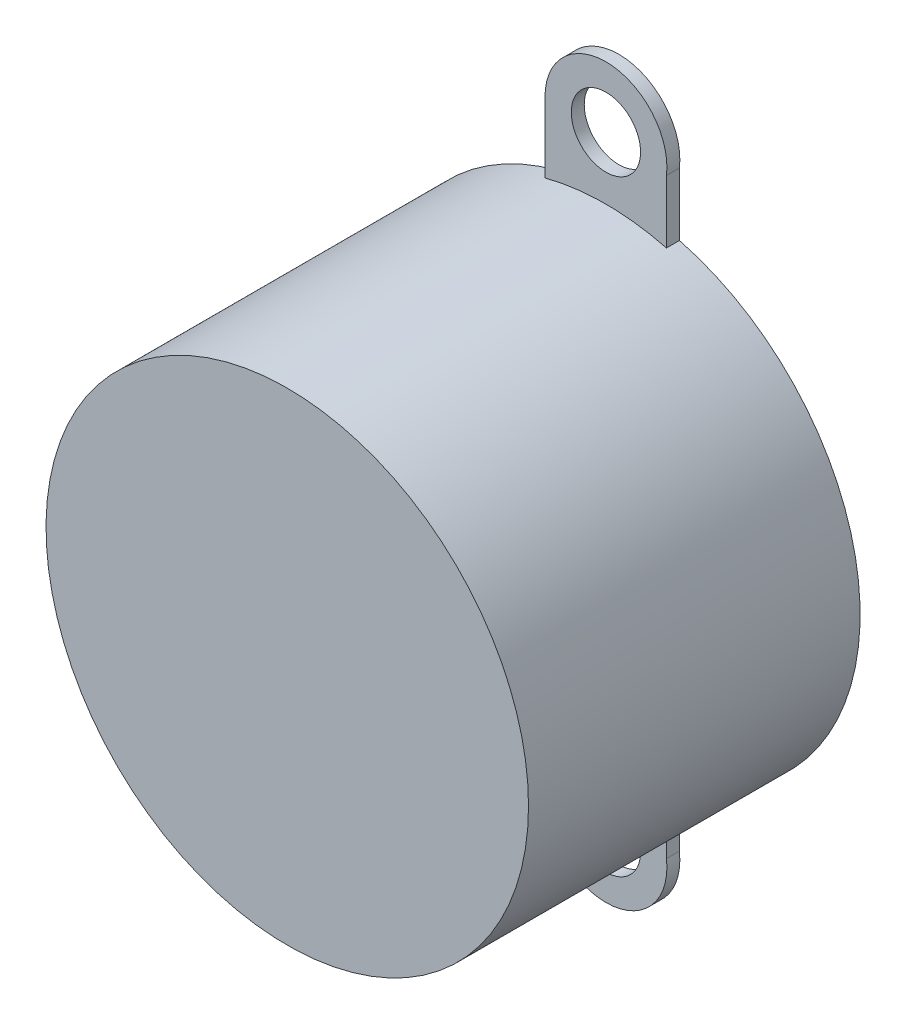
from build123d import *

# Parameters (mm, degrees)
SKETCH1_R           = 13.97
BOSS_EXTRUDE1_DEPTH = 19.2024
SKETCH1_3_R         = 2.0066
BOSS_EXTRUDE2_DEPTH = 0.7493
SKETCH2_R           = 4.5212
BOSS_EXTRUDE3_DEPTH = 1.5748
SKETCH3_R           = 2.4511
BOSS_EXTRUDE4_DEPTH = 8.3312


with BuildPart() as part:
    # Sketch1 → Boss-Extrude1 (new body)
    with BuildSketch(Plane.XY):
        Circle(SKETCH1_R)
    extrude(amount=BOSS_EXTRUDE1_DEPTH)

    # Sketch1<3> → Boss-Extrude2 (add)
    # profile 1 of 2: a face of its own
    with BuildSketch(Plane.XY):
        with BuildLine():
            Line((3.5052, 13.52310885), (3.5052, 17.154059749))
            ThreePointArc((3.5052, 17.154059749), (0.211751316, 21.101044279), (-3.5306, 17.5768))
            Line((-3.5306, 17.5768), (-3.5306, 13.516499682))
            ThreePointArc((-3.5306, 13.516499682), (-0.013122891, 13.969993836), (3.5052, 13.52310885))
        make_face()
        with Locations((0, 17.5768)):
            Circle(SKETCH1_3_R, mode=Mode.SUBTRACT)
    # profile 2 of 2: a face of its own
    with BuildSketch(Plane.XY):
        with BuildLine():
            ThreePointArc((3.5052, -13.52310885), (-0.013122891, -13.969993836), (-3.5306, -13.516499682))
            Line((-3.5306, -13.516499682), (-3.5306, -17.526))
            ThreePointArc((-3.5306, -17.526), (0.211751316, -21.050244279), (3.5052, -17.103259749))
            Line((3.5052, -17.103259749), (3.5052, -13.52310885))
        make_face()
        with Locations((0, -17.526)):
            Circle(SKETCH1_3_R, mode=Mode.SUBTRACT)
    extrude(amount=BOSS_EXTRUDE2_DEPTH)

    # Sketch2 → Boss-Extrude3 (add)
    with BuildSketch(Plane.XY):
        with Locations((-7.746833441, 0.0508)):
            Circle(SKETCH2_R)
    extrude(amount=-BOSS_EXTRUDE3_DEPTH)

    # Sketch3 → Boss-Extrude4 (add)
    with BuildSketch(Plane(origin=(0, 0, -1.5748), x_dir=(-1, 0, 0), z_dir=(0, 0, -1))):
        with Locations((7.746833441, 0.0508)):
            Circle(SKETCH3_R)
    extrude(amount=BOSS_EXTRUDE4_DEPTH)


solid = part.part
